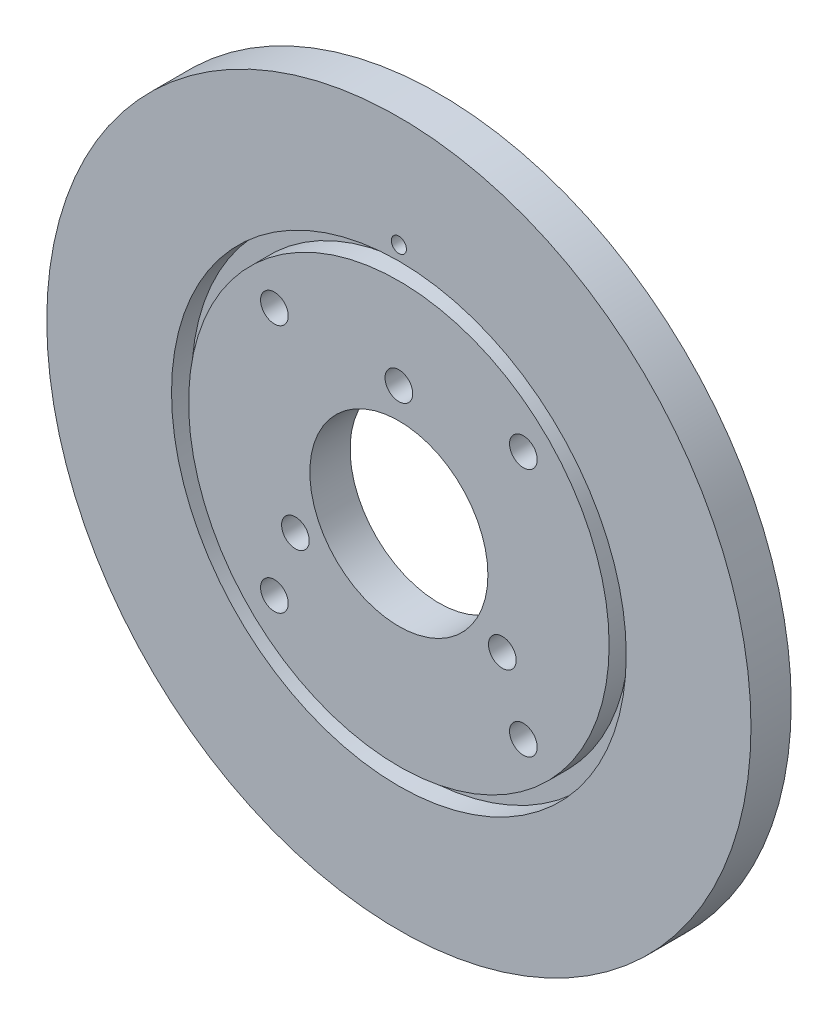
from build123d import *

# Parameters (mm, degrees)
SKETCH_1_R          = 70
SKETCH_1_R_2        = 17.7
SKETCH_1_R_3        = 2.75
SKETCH_1_R_4        = 1.5
EXTRUDE_1_DEPTH     = 8
SKETCH_2_R          = 45.2
SKETCH_2_R_2        = 41.8
CUT_EXTRUDE_2_DEPTH = 4


with BuildPart() as part:
    # 草图1 → 凸台-拉伸1 (new body)
    with BuildSketch(Plane.XY):
        Circle(SKETCH_1_R)
        Circle(SKETCH_1_R_2, mode=Mode.SUBTRACT)
        with Locations((24.748737342, 24.748737342)):
            Circle(SKETCH_1_R_3, mode=Mode.SUBTRACT)
        with Locations((-24.748737342, 24.748737342)):
            Circle(SKETCH_1_R_3, mode=Mode.SUBTRACT)
        with Locations((-24.748737342, -24.748737342)):
            Circle(SKETCH_1_R_3, mode=Mode.SUBTRACT)
        with Locations((24.748737342, -24.748737342)):
            Circle(SKETCH_1_R_3, mode=Mode.SUBTRACT)
        with Locations((0, 23.75)):
            Circle(SKETCH_1_R_3, mode=Mode.SUBTRACT)
        with Locations((-20.56810334, -11.875)):
            Circle(SKETCH_1_R_3, mode=Mode.SUBTRACT)
        with Locations((20.56810334, -11.875)):
            Circle(SKETCH_1_R_3, mode=Mode.SUBTRACT)
        with Locations((0, 48)):
            Circle(SKETCH_1_R_4, mode=Mode.SUBTRACT)
    extrude(amount=-EXTRUDE_1_DEPTH)

    # 草图2 → 切除-拉伸2 (cut)
    with BuildSketch(Plane.XY):
        Circle(SKETCH_2_R)
        Circle(SKETCH_2_R_2, mode=Mode.SUBTRACT)
    extrude(amount=-CUT_EXTRUDE_2_DEPTH, mode=Mode.SUBTRACT)


solid = part.part
